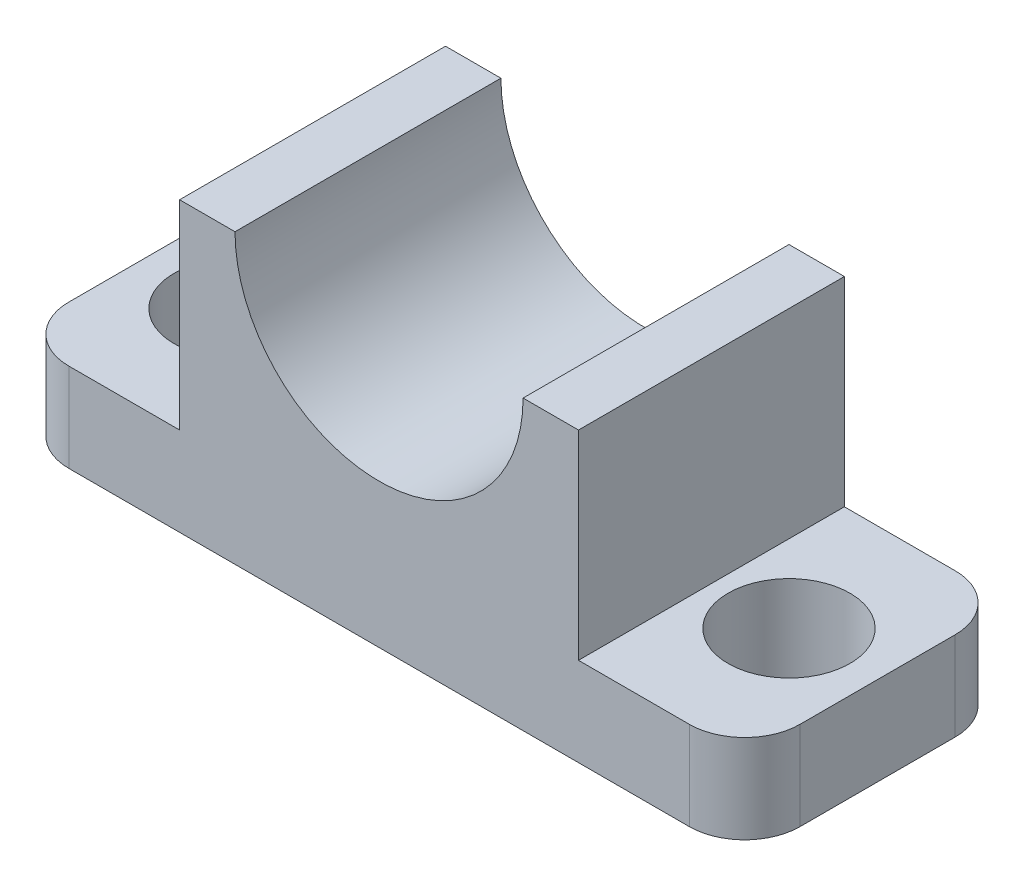
from build123d import *

# Parameters (mm, degrees)
EXTRUDE_1_DEPTH     = 12
SKETCH_2_R          = 5.5
CUT_EXTRUDE_1_DEPTH = 40.458839314
FILLET_1_R          = 5


with BuildPart() as part:
    # 草图1 → 凸台-拉伸1 (new, symmetric)
    with BuildSketch(Plane.XY):
        with BuildLine():
            Line((-33, 0), (33, 0))
            Line((33, 0), (33, 8))
            Line((33, 8), (18, 8))
            Line((18, 8), (18, 26))
            Line((18, 26), (13, 26))
            ThreePointArc((13, 26), (0, 13), (-13, 26))
            Line((-13, 26), (-18, 26))
            Line((-18, 26), (-18, 8))
            Line((-18, 8), (-33, 8))
            Line((-33, 8), (-33, 0))
        make_face()
    extrude(amount=EXTRUDE_1_DEPTH, both=True)

    # 草图2 → 切除-拉伸1 (cut, through all)
    with BuildSketch(Plane(origin=(0, 8, 0), x_dir=(1, 0, 0), z_dir=(0, 1, 0))):
        with Locations(Location((25, 0, 0), (0, 0, 180))):
            Circle(SKETCH_2_R)
        with Locations((-25, 0)):
            Circle(SKETCH_2_R)
    extrude(amount=-CUT_EXTRUDE_1_DEPTH, mode=Mode.SUBTRACT)

    # 圆角1
    fillet_1_edges = [part.edges().sort_by_distance(p)[0] for p in [
        (33, 4, -12),
        (-33, 4, -12),
        (-33, 4, 12),
        (33, 4, 12),
    ]]
    fillet(fillet_1_edges, radius=FILLET_1_R)


solid = part.part
